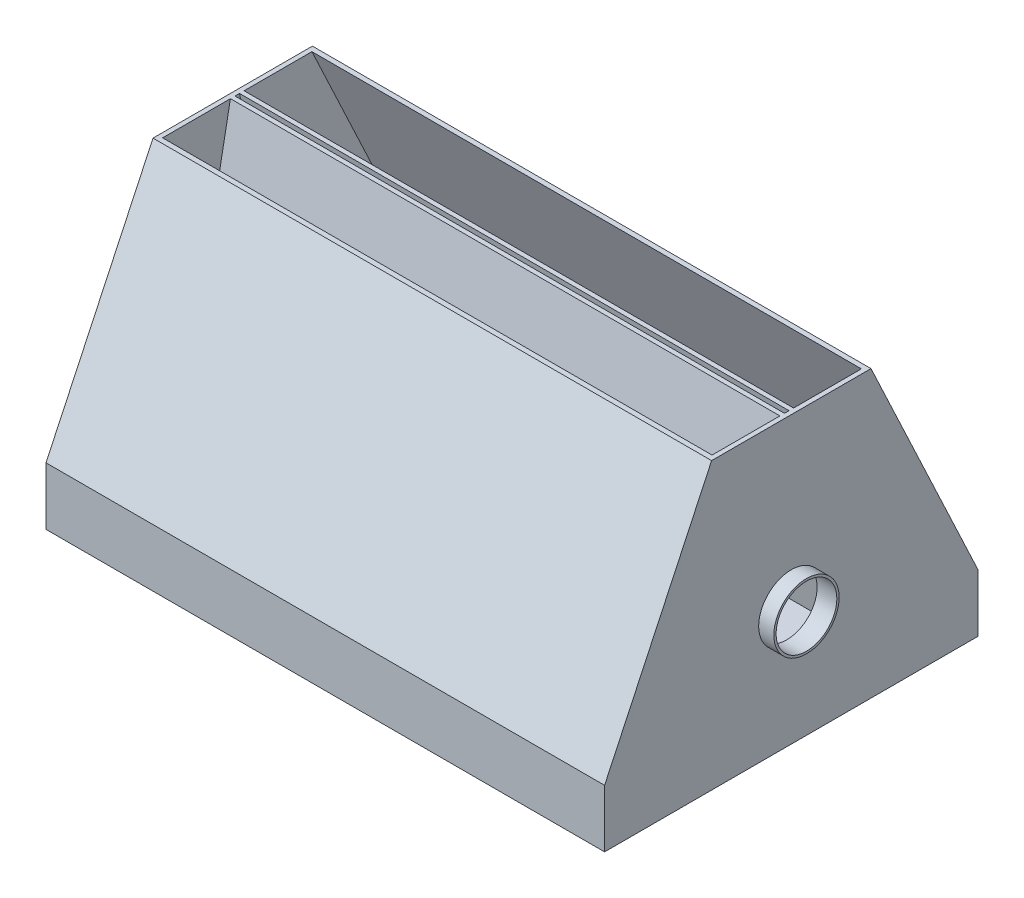
from build123d import *

# Parameters (mm, degrees)
BOSS_EXTRUDE1_DEPTH = 368
SHELL2_T            = -3
BOSS_EXTRUDE3_REACH = 402.691
CUT_EXTRUDE1_REACH  = 402.691
SKETCH9_R           = 20
BOSS_EXTRUDE4_START = 10
SKETCH10_R          = 21.5
SKETCH10_R_2        = 20
BOSS_EXTRUDE4_DEPTH = 10
SKETCH11_W          = 368
SKETCH11_H          = 246
SKETCH11_W_2        = 362
SKETCH11_H_2        = 240
BOSS_EXTRUDE5_DEPTH = 38


with BuildPart() as part:
    # Sketch2 → Boss-Extrude1 (new body)
    with BuildSketch(Plane(origin=(0, 0, 0), x_dir=(0, 0, -1), z_dir=(1, 0, 0))):
        Polygon((123, -50), (-123, -50), (-52.5, 100), (52.5, 100), align=None)
    extrude(amount=BOSS_EXTRUDE1_DEPTH)

    # Shell2
    shell2_openings = [part.faces().sort_by_distance(p)[0] for p in [
        (184, 100, 0),
        (184, -50, 0),
    ]]
    offset(amount=SHELL2_T, openings=shell2_openings, kind=Kind.INTERSECTION)

    # Sketch8 → Boss-Extrude3 (add, up to next)
    with BuildSketch(Plane(origin=(368, 0, 0), x_dir=(0, 0, -1), z_dir=(1, 0, 0)), mode=Mode.PRIVATE) as boss_extrude3_sk1:
        Polygon((-4.5, 100), (-30, -35), (30, -35), (4.5, 100), (1.5, 100), (26.433333333, -32), (-26.433333333, -32), (-1.5, 100), align=None)
    boss_extrude3_tool1 = extrude(boss_extrude3_sk1.sketch, amount=-BOSS_EXTRUDE3_REACH, mode=Mode.PRIVATE) - part.part
    add(boss_extrude3_tool1.solids().sort_by_distance((368, 34.274202, 15.418325))[0])

    # Sketch9 → Cut-Extrude1 (cut, up to next)
    with BuildSketch(Plane(origin=(368, 0, 0), x_dir=(0, 0, -1), z_dir=(1, 0, 0)), mode=Mode.PRIVATE) as cut_extrude1_sk1:
        with Locations((0, -10)):
            Circle(SKETCH9_R)
    cut_extrude1_tool1 = extrude(cut_extrude1_sk1.sketch, amount=-CUT_EXTRUDE1_REACH, mode=Mode.PRIVATE) & part.part
    add(cut_extrude1_tool1.solids().sort_by_distance((368, -10, 0))[0], mode=Mode.SUBTRACT)

    # Sketch10 → Boss-Extrude4 (add)
    with BuildSketch(Plane(origin=(368, 0, 0), x_dir=(0, 0, -1), z_dir=(1, 0, 0)).offset(BOSS_EXTRUDE4_START)):
        with Locations(Location((0, -10, 0), (0, 0, 180))):
            Circle(SKETCH10_R)
        with Locations((0, -10)):
            Circle(SKETCH10_R_2, mode=Mode.SUBTRACT)
    extrude(amount=-BOSS_EXTRUDE4_DEPTH)

    # Sketch11 → Boss-Extrude5 (add)
    with BuildSketch(Plane.XZ.offset(50)):
        with Locations((184, 0)):
            Rectangle(SKETCH11_W, SKETCH11_H)
        with Locations((184, 0)):
            Rectangle(SKETCH11_W_2, SKETCH11_H_2, mode=Mode.SUBTRACT)
    extrude(amount=BOSS_EXTRUDE5_DEPTH)


solid = part.part
